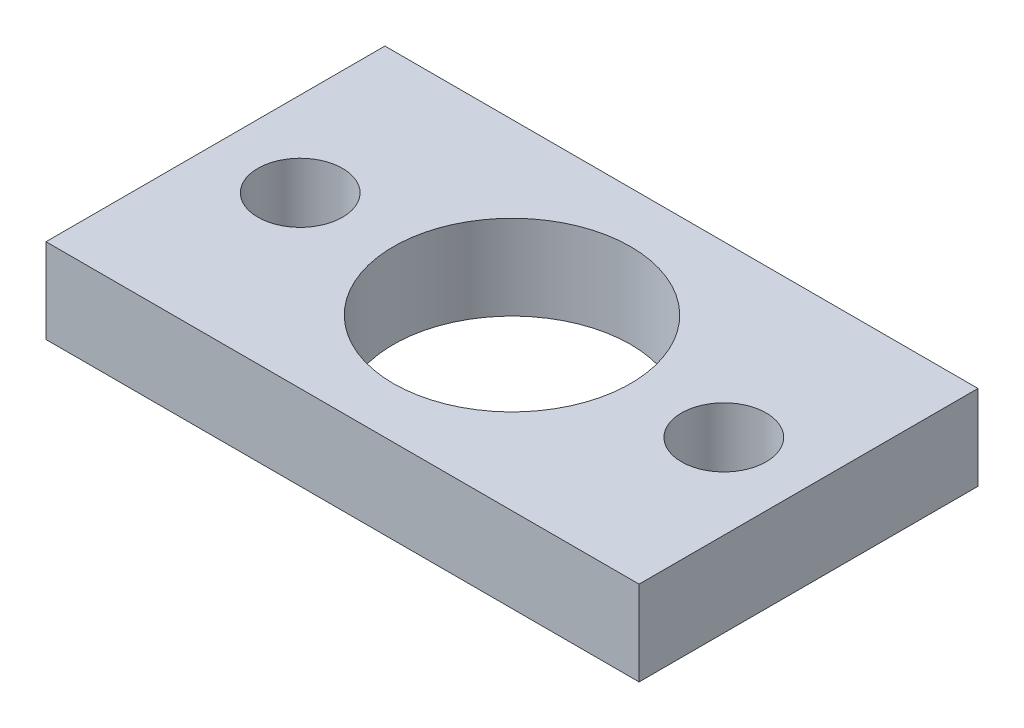
from build123d import *

# Parameters (mm, degrees)
SKETCH1_W           = 35
SKETCH1_H           = 20
SKETCH1_R           = 7
SKETCH1_R_2         = 2.5
BOSS_EXTRUDE1_DEPTH = 2.5


with BuildPart() as part:
    # Sketch1 → Boss-Extrude1 (new, symmetric)
    with BuildSketch(Plane(origin=(0, 0, 0), x_dir=(1, 0, 0), z_dir=(0, 1, 0))):
        Rectangle(SKETCH1_W, SKETCH1_H)
        with Locations(Location((0, 0, 0), (0, 0, 270))):
            Circle(SKETCH1_R, mode=Mode.SUBTRACT)
        with Locations(Location((12.5, 0, 0), (0, 0, 270))):
            Circle(SKETCH1_R_2, mode=Mode.SUBTRACT)
        with Locations(Location((-12.5, 0, 0), (0, 0, 270))):
            Circle(SKETCH1_R_2, mode=Mode.SUBTRACT)
    extrude(amount=BOSS_EXTRUDE1_DEPTH, both=True)


solid = part.part
